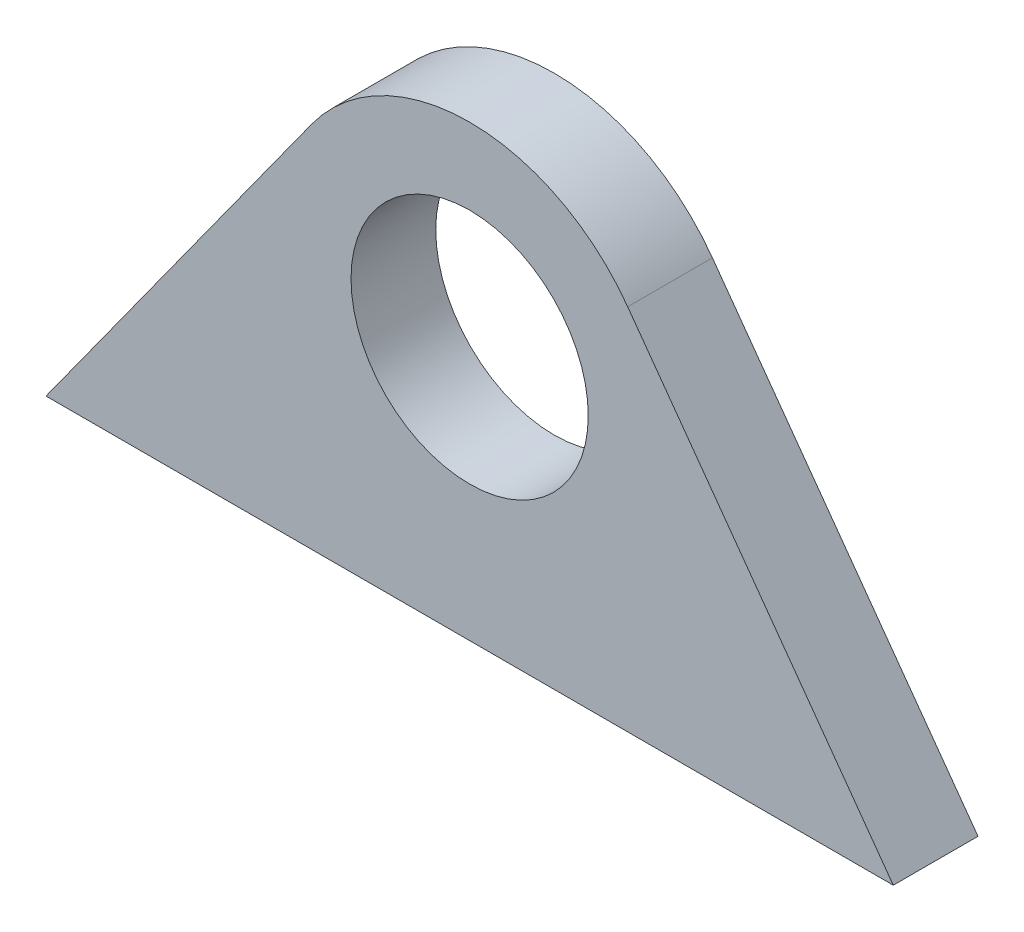
from build123d import *

# Parameters (mm, degrees)
SKETCH1_R           = 7
BOSS_EXTRUDE1_DEPTH = 5


with BuildPart() as part:
    # Sketch1 → Boss-Extrude1 (new body)
    with BuildSketch(Plane.XY):
        with BuildLine():
            Line((-25, -15), (25, -15))
            Line((25, -15), (9.326673849, 6.727789749))
            ThreePointArc((9.326673849, 6.727789749), (0, 11.5), (-9.326673849, 6.727789749))
            Line((-9.326673849, 6.727789749), (-25, -15))
        make_face()
        Circle(SKETCH1_R, mode=Mode.SUBTRACT)
    extrude(amount=BOSS_EXTRUDE1_DEPTH)


solid = part.part
